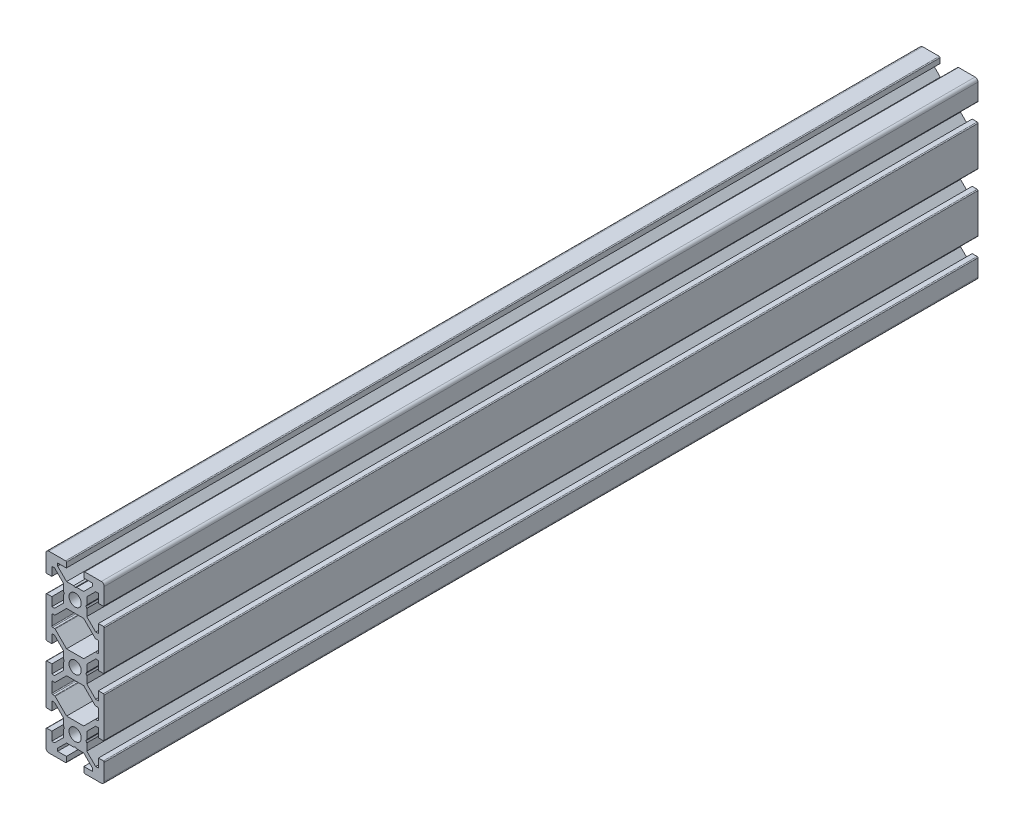
from build123d import *

# Parameters (mm, degrees)
SKETCH1_R           = 2.0999999
BOSS_EXTRUDE1_DEPTH = 300


with BuildPart() as part:
    # Sketch1 → Boss-Extrude1 (new body)
    with BuildSketch(Plane.XY):
        with BuildLine():
            Line((-10, 16.7), (-10, 3.3))
            ThreePointArc((-10, 3.3), (-9.912132034, 3.087867966), (-9.7, 3))
            Line((-9.7, 3), (-8, 3))
            Line((-8, 3), (-8, 6))
            Line((-8, 6), (-7.060650687, 6))
            Line((-7.060650687, 6), (-4, 2.939349))
            Line((-4, 2.939349), (-4, 0.519615242))
            Line((-4, 0.519615242), (-3.7, 0))
            Line((-3.7, 0), (-4, -0.519615242))
            Line((-4, -0.519615242), (-4, -2.9393502))
            Line((-4, -2.9393502), (-7.060649487, -6))
            Line((-7.060649487, -6), (-8, -6))
            Line((-8, -6), (-8, -3))
            Line((-8, -3), (-9.7, -3))
            ThreePointArc((-9.7, -3), (-9.912132034, -3.087867966), (-10, -3.3))
            Line((-10, -3.3), (-10, -16.7))
            ThreePointArc((-10, -16.7), (-9.912132034, -16.912132034), (-9.7, -17))
            Line((-9.7, -17), (-8, -17))
            Line((-8, -17), (-8, -14))
            Line((-8, -14), (-7.060672887, -14))
            Line((-7.060672887, -14), (-4, -17.0606732))
            Line((-4, -17.0606732), (-4, -19.480384758))
            Line((-4, -19.480384758), (-3.7, -20))
            Line((-3.7, -20), (-4, -20.519615242))
            Line((-4, -20.519615242), (-4, -22.93935665))
            Line((-4, -22.93935665), (-7.060643037, -26))
            Line((-7.060643037, -26), (-8, -26))
            Line((-8, -26), (-8, -23))
            Line((-8, -23), (-9.7, -23))
            ThreePointArc((-9.7, -23), (-9.912132034, -23.087867966), (-10, -23.3))
            Line((-10, -23.3), (-10, -29))
            ThreePointArc((-10, -29), (-9.707106781, -29.707106781), (-9, -30))
            Line((-9, -30), (-3.3, -30))
            ThreePointArc((-3.3, -30), (-3.087867966, -29.912132034), (-3, -29.7))
            Line((-3, -29.7), (-3, -28))
            Line((-3, -28), (-6, -28))
            Line((-6, -28), (-6, -27.060683408))
            Line((-6, -27.060683408), (-2.939316, -24))
            Line((-2.939316, -24), (-0.519095055, -24))
            Line((-0.519095055, -24), (1e-06, -23.7))
            Line((1e-06, -23.7), (0.518577868, -24))
            Line((0.518577868, -24), (2.939318, -24))
            Line((2.939318, -24), (6, -27.060682403))
            Line((6, -27.060682403), (6, -28))
            Line((6, -28), (3, -28))
            Line((3, -28), (3, -29.7))
            ThreePointArc((3, -29.7), (3.087867966, -29.912132034), (3.3, -30))
            Line((3.3, -30), (9, -30))
            ThreePointArc((9, -30), (9.707106781, -29.707106781), (10, -29))
            Line((10, -29), (10, -23.3))
            ThreePointArc((10, -23.3), (9.912132034, -23.087867966), (9.7, -23))
            Line((9.7, -23), (8, -23))
            Line((8, -23), (8, -26))
            Line((8, -26), (7.060637687, -26))
            Line((7.060637687, -26), (4, -22.93935641))
            Line((4, -22.93935641), (4, -20.519623992))
            Line((4, -20.519623992), (3.7, -20.00000875))
            Line((3.7, -20.00000875), (4, -19.480393508))
            Line((4, -19.480393508), (4, -17.06066109))
            Line((4, -17.06066109), (7.060655187, -14))
            Line((7.060655187, -14), (8, -14))
            Line((8, -14), (8, -17))
            Line((8, -17), (9.7, -17))
            ThreePointArc((9.7, -17), (9.912132034, -16.912132034), (10, -16.7))
            Line((10, -16.7), (10, -3.3))
            ThreePointArc((10, -3.3), (9.912132034, -3.087867966), (9.7, -3))
            Line((9.7, -3), (8, -3))
            Line((8, -3), (8, -6))
            Line((8, -6), (7.060651537, -6))
            Line((7.060651537, -6), (4, -2.93934815))
            Line((4, -2.93934815), (4, -0.519623992))
            Line((4, -0.519623992), (3.7, -8.75e-06))
            Line((3.7, -8.75e-06), (4, 0.519606492))
            Line((4, 0.519606492), (4, 2.9393426))
            Line((4, 2.9393426), (7.060657087, 6))
            Line((7.060657087, 6), (8, 6))
            Line((8, 6), (8, 3))
            Line((8, 3), (9.7, 3))
            ThreePointArc((9.7, 3), (9.912132034, 3.087867966), (10, 3.3))
            Line((10, 3.3), (10, 16.7))
            ThreePointArc((10, 16.7), (9.912132034, 16.912132034), (9.7, 17))
            Line((9.7, 17), (8, 17))
            Line((8, 17), (8, 14))
            Line((8, 14), (7.06065821, 14))
            Line((7.06065821, 14), (4, 17.060658523))
            Line((4, 17.060658523), (4, 19.480376008))
            Line((4, 19.480376008), (3.7, 19.99999125))
            Line((3.7, 19.99999125), (4, 20.519606492))
            Line((4, 20.519606492), (4, 22.939362173))
            Line((4, 22.939362173), (7.060637514, 26))
            Line((7.060637514, 26), (8, 26))
            Line((8, 26), (8, 23))
            Line((8, 23), (9.7, 23))
            ThreePointArc((9.7, 23), (9.912132034, 23.087867966), (10, 23.3))
            Line((10, 23.3), (10, 29))
            ThreePointArc((10, 29), (9.707106781, 29.707106781), (9, 30))
            Line((9, 30), (3.3, 30))
            ThreePointArc((3.3, 30), (3.087867966, 29.912132034), (3, 29.7))
            Line((3, 29.7), (3, 28))
            Line((3, 28), (6, 28))
            Line((6, 28), (6, 27.060684313))
            Line((6, 27.060684313), (2.939316, 24))
            Line((2.939316, 24), (0.519614242, 24))
            Line((0.519614242, 24), (-1e-06, 23.7))
            Line((-1e-06, 23.7), (-0.519616242, 24))
            Line((-0.519616242, 24), (-2.939318, 24))
            Line((-2.939318, 24), (-6, 27.060682313))
            Line((-6, 27.060682313), (-6, 28))
            Line((-6, 28), (-3, 28))
            Line((-3, 28), (-3, 29.7))
            ThreePointArc((-3, 29.7), (-3.087867966, 29.912132034), (-3.3, 30))
            Line((-3.3, 30), (-9, 30))
            ThreePointArc((-9, 30), (-9.707106781, 29.707106781), (-10, 29))
            Line((-10, 29), (-10, 23.3))
            ThreePointArc((-10, 23.3), (-9.912132034, 23.087867966), (-9.7, 23))
            Line((-9.7, 23), (-8, 23))
            Line((-8, 23), (-8, 26))
            Line((-8, 26), (-7.060644014, 26))
            Line((-7.060644014, 26), (-4, 22.939355673))
            Line((-4, 22.939355673), (-4, 20.519615242))
            Line((-4, 20.519615242), (-3.7, 20))
            Line((-3.7, 20), (-4, 19.480384758))
            Line((-4, 19.480384758), (-4, 17.060669373))
            Line((-4, 17.060669373), (-7.06066906, 14))
            Line((-7.06066906, 14), (-8, 14))
            Line((-8, 14), (-8, 17))
            Line((-8, 17), (-9.7, 17))
            ThreePointArc((-9.7, 17), (-9.912132034, 16.912132034), (-10, 16.7))
        make_face()
        with Locations((0, 20.000013123)):
            Circle(SKETCH1_R, mode=Mode.SUBTRACT)
        Circle(SKETCH1_R, mode=Mode.SUBTRACT)
        with Locations((0, -20.000013525)):
            Circle(SKETCH1_R, mode=Mode.SUBTRACT)
        with BuildLine():
            Line((-7.7, 8), (-7.063594325, 8))
            ThreePointArc((-7.063594325, 8), (-6.948789288, 7.977163857), (-6.85146228, 7.912132024))
            Line((-6.85146228, 7.912132024), (-2.939330656, 4))
            Line((-2.939330656, 4), (2.939337056, 4))
            Line((2.939337056, 4), (6.85146868, 7.912132024))
            ThreePointArc((6.85146868, 7.912132024), (6.948795688, 7.977163857), (7.063600725, 8))
            Line((7.063600725, 8), (7.7, 8))
            ThreePointArc((7.7, 8), (7.912132034, 8.087867966), (8, 8.3))
            Line((8, 8.3), (8, 11.7))
            ThreePointArc((8, 11.7), (7.912132034, 11.912132034), (7.7, 12))
            Line((7.7, 12), (7.063601848, 12))
            ThreePointArc((7.063601848, 12), (6.948796811, 12.022836143), (6.851469803, 12.087867976))
            Line((6.851469803, 12.087867976), (2.939338179, 16))
            Line((2.939338179, 16), (-2.939349029, 16))
            Line((-2.939349029, 16), (-6.851480653, 12.087867976))
            ThreePointArc((-6.851480653, 12.087867976), (-6.948807661, 12.022836143), (-7.063612698, 12))
            Line((-7.063612698, 12), (-7.7, 12))
            ThreePointArc((-7.7, 12), (-7.912132034, 11.912132034), (-8, 11.7))
            Line((-8, 11.7), (-8, 8.3))
            ThreePointArc((-8, 8.3), (-7.912132034, 8.087867966), (-7.7, 8))
        make_face(mode=Mode.SUBTRACT)
        with BuildLine():
            Line((-8, -8.3), (-8, -11.7))
            ThreePointArc((-8, -11.7), (-7.912132034, -11.912132034), (-7.7, -12))
            Line((-7.7, -12), (-7.063616525, -12))
            ThreePointArc((-7.063616525, -12), (-6.948811488, -12.022836143), (-6.85148448, -12.087867976))
            Line((-6.85148448, -12.087867976), (-2.939352856, -16))
            Line((-2.939352856, -16), (2.939340746, -16))
            Line((2.939340746, -16), (6.851465031, -12.08786817))
            ThreePointArc((6.851465031, -12.08786817), (6.948792107, -12.022836196), (7.06359727, -12))
            Line((7.06359727, -12), (7.7, -12))
            ThreePointArc((7.7, -12), (7.912132034, -11.912132034), (8, -11.7))
            Line((8, -11.7), (8, -8.3))
            ThreePointArc((8, -8.3), (7.912132034, -8.087867966), (7.7, -8))
            Line((7.7, -8), (7.063595175, -8))
            ThreePointArc((7.063595175, -8), (6.948790138, -7.977163857), (6.85146313, -7.912132024))
            Line((6.85146313, -7.912132024), (2.939331506, -4))
            Line((2.939331506, -4), (-2.939329456, -4))
            Line((-2.939329456, -4), (-6.85146108, -7.912132024))
            ThreePointArc((-6.85146108, -7.912132024), (-6.948788088, -7.977163857), (-7.063593125, -8))
            Line((-7.063593125, -8), (-7.7, -8))
            ThreePointArc((-7.7, -8), (-7.912132034, -8.087867966), (-8, -8.3))
        make_face(mode=Mode.SUBTRACT)
    extrude(amount=-BOSS_EXTRUDE1_DEPTH)


solid = part.part
